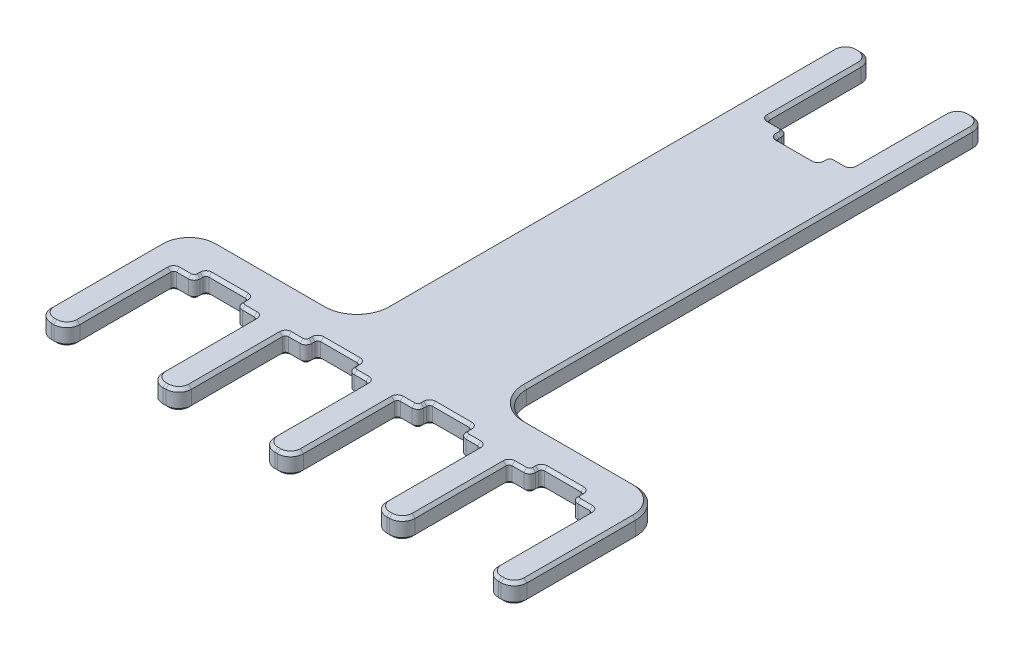
from build123d import *

# Parameters (mm, degrees)
BOSS_EXTRUDE1_DEPTH = 3.4
SKETCH3_W           = 7.2
SKETCH3_H           = 2
CUT_EXTRUDE1_DEPTH  = 3.4
FILLET1_R           = 5
FILLET2_R           = 2.2
FILLET3_R           = 0.5
FILLET4_R           = 1
CHAMFER1_SIZE       = 0.5


with BuildPart() as part:
    # Sketch1 → Boss-Extrude1 (new body)
    with BuildSketch(Plane(origin=(0, 0, 0), x_dir=(1, 0, 0), z_dir=(0, 1, 0))):
        Polygon((-29.141666667, 5.925), (-0.566666667, 5.925), (-0.566666667, 89.125), (4.283333333, 89.125), (4.283333333, 70.925), (18.483333333, 70.925), (18.483333333, 89.125), (23.333333333, 89.125), (23.333333333, 5.925), (51.908333333, 5.925), (51.908333333, -19.775), (-29.141666667, -19.775), align=None)
    extrude(amount=BOSS_EXTRUDE1_DEPTH)

    # Sketch3 → Cut-Extrude1 (cut)
    with BuildSketch(Plane(origin=(0, 3.4, 0), x_dir=(1, 0, 0), z_dir=(0, 1, 0))):
        Polygon((-24.291666667, -1.575), (-24.291666667, -19.775), (-10.091666667, -19.775), (-10.091666667, -1.575), (-13.591666667, -1.575), (-13.591666667, 0.425), (-20.791666667, 0.425), (-20.791666667, -1.575), align=None)
        Polygon((-5.241666667, -1.575), (-5.241666667, -19.775), (8.958333333, -19.775), (8.958333333, -1.575), (5.458333333, -1.575), (5.458333333, 0.425), (-1.741666667, 0.425), (-1.741666667, -1.575), align=None)
        Polygon((13.808333333, -1.575), (13.808333333, -19.775), (28.008333333, -19.775), (28.008333333, -1.575), (24.508333333, -1.575), (24.508333333, 0.425), (17.308333333, 0.425), (17.308333333, -1.575), align=None)
        Polygon((32.858333333, -1.575), (32.858333333, -19.775), (47.058333333, -19.775), (47.058333333, -1.575), (43.558333333, -1.575), (43.558333333, 0.425), (36.358333333, 0.425), (36.358333333, -1.575), align=None)
        with Locations((11.383333333, 69.925)):
            Rectangle(SKETCH3_W, SKETCH3_H)
    extrude(amount=-CUT_EXTRUDE1_DEPTH, mode=Mode.SUBTRACT)

    # Fillet1
    fillet1_edges = [part.edges().sort_by_distance(p)[0] for p in [
        (-29.141666667, 1.7, -5.925),
        (-0.566666667, 1.7, -5.925),
        (23.333333333, 1.7, -5.925),
        (51.908333333, 1.7, -5.925),
    ]]
    fillet(fillet1_edges, radius=FILLET1_R)

    # Fillet2
    fillet2_edges = [part.edges().sort_by_distance(p)[0] for p in [
        (28.008333333, 1.7, 19.775),
        (13.808333333, 1.7, 19.775),
        (8.958333333, 1.7, 19.775),
        (-5.241666667, 1.7, 19.775),
        (-0.566666667, 1.7, -89.125),
        (4.283333333, 1.7, -89.125),
        (18.483333333, 1.7, -89.125),
        (23.333333333, 1.7, -89.125),
        (51.908333333, 1.7, 19.775),
        (-29.141666667, 1.7, 19.775),
        (-10.091666667, 1.7, 19.775),
        (-24.291666667, 1.7, 19.775),
        (47.058333333, 1.7, 19.775),
        (32.858333333, 1.7, 19.775),
    ]]
    fillet(fillet2_edges, radius=FILLET2_R)

    # Fillet3
    fillet3_edges = [part.edges().sort_by_distance(p)[0] for p in [
        (13.808333333, 1.7, 1.575),
        (17.308333333, 1.7, -0.425),
        (24.508333333, 1.7, -0.425),
        (28.008333333, 1.7, 1.575),
        (-5.241666667, 1.7, 1.575),
        (-1.741666667, 1.7, -0.425),
        (5.458333333, 1.7, -0.425),
        (8.958333333, 1.7, 1.575),
        (4.283333333, 1.7, -70.925),
        (18.483333333, 1.7, -70.925),
        (-24.291666667, 1.7, 1.575),
        (-20.791666667, 1.7, -0.425),
        (-13.591666667, 1.7, -0.425),
        (-10.091666667, 1.7, 1.575),
        (14.983333333, 1.7, -68.925),
        (7.783333333, 1.7, -68.925),
        (32.858333333, 1.7, 1.575),
        (36.358333333, 1.7, -0.425),
        (43.558333333, 1.7, -0.425),
        (47.058333333, 1.7, 1.575),
    ]]
    fillet(fillet3_edges, radius=FILLET3_R)

    # Fillet4
    fillet4_edges = [part.edges().sort_by_distance(p)[0] for p in [
        (17.308333333, 1.7, 1.575),
        (24.508333333, 1.7, 1.575),
        (-1.741666667, 1.7, 1.575),
        (5.458333333, 1.7, 1.575),
        (-20.791666667, 1.7, 1.575),
        (-13.591666667, 1.7, 1.575),
        (7.783333333, 1.7, -70.925),
        (14.983333333, 1.7, -70.925),
        (36.358333333, 1.7, 1.575),
        (43.558333333, 1.7, 1.575),
    ]]
    fillet(fillet4_edges, radius=FILLET4_R)

    # Chamfer1
    chamfer1_edges = [part.edges().sort_by_distance(p)[0] for p in [
        (-29.141666667, 0, 8.325),
        (-29.141666667, 3.4, 8.325),
        (-14.854166667, 0, -5.925),
        (23.333333333, 0, -48.925),
        (37.620833333, 0, -5.925),
        (50.443867239, 0, -4.460533906),
        (-27.677200573, 0, -4.460533906),
        (-14.854166667, 3.4, -5.925),
        (37.620833333, 3.4, -5.925),
        (23.333333333, 3.4, -48.925),
        (50.443867239, 3.4, -4.460533906),
        (-27.677200573, 3.4, -4.460533906),
        (24.797799427, 0, -7.389466094),
        (24.797799427, 3.4, -7.389466094),
        (-2.031132761, 0, -7.389466094),
        (-2.031132761, 3.4, -7.389466094),
        (-0.566666667, 0, -48.925),
        (-0.566666667, 3.4, -48.925),
        (1.858333333, 0, -89.125),
        (18.483333333, 0, -79.175),
        (20.908333333, 0, -89.125),
        (51.908333333, 0, 8.325),
        (49.483333333, 0, 19.775),
        (47.058333333, 0, 9.825),
        (30.433333333, 0, 19.775),
        (28.008333333, 0, 9.825),
        (11.383333333, 0, 19.775),
        (8.958333333, 0, 9.825),
        (-7.666666667, 0, 19.775),
        (-10.091666667, 0, 9.825),
        (-26.716666667, 0, 19.775),
        (-28.497301585, 0, 19.130634919),
        (-24.936031748, 0, 19.130634919),
        (-9.447301585, 0, 19.130634919),
        (-5.886031748, 0, 19.130634919),
        (9.602698415, 0, 19.130634919),
        (13.163968252, 0, 19.130634919),
        (28.652698415, 0, 19.130634919),
        (32.213968252, 0, 19.130634919),
        (47.702698415, 0, 19.130634919),
        (51.263968252, 0, 19.130634919),
        (22.688968252, 0, -88.480634919),
        (19.127698415, 0, -88.480634919),
        (3.638968252, 0, -88.480634919),
        (0.077698415, 0, -88.480634919),
        (1.858333333, 3.4, -89.125),
        (-26.716666667, 3.4, 19.775),
        (-10.091666667, 3.4, 9.825),
        (-7.666666667, 3.4, 19.775),
        (8.958333333, 3.4, 9.825),
        (11.383333333, 3.4, 19.775),
        (28.008333333, 3.4, 9.825),
        (30.433333333, 3.4, 19.775),
        (47.058333333, 3.4, 9.825),
        (49.483333333, 3.4, 19.775),
        (51.908333333, 3.4, 8.325),
        (20.908333333, 3.4, -89.125),
        (18.483333333, 3.4, -79.175),
        (-28.497301585, 3.4, 19.130634919),
        (-24.936031748, 3.4, 19.130634919),
        (-9.447301585, 3.4, 19.130634919),
        (-5.886031748, 3.4, 19.130634919),
        (9.602698415, 3.4, 19.130634919),
        (13.163968252, 3.4, 19.130634919),
        (28.652698415, 3.4, 19.130634919),
        (32.213968252, 3.4, 19.130634919),
        (47.702698415, 3.4, 19.130634919),
        (51.263968252, 3.4, 19.130634919),
        (22.688968252, 3.4, -88.480634919),
        (19.127698415, 3.4, -88.480634919),
        (3.638968252, 3.4, -88.480634919),
        (0.077698415, 3.4, -88.480634919),
        (11.383333333, 3.4, -68.925),
        (11.383333333, 0, -68.925),
        (14.983333333, 3.4, -69.675),
        (14.983333333, 0, -69.675),
        (16.983333333, 0, -70.925),
        (16.983333333, 3.4, -70.925),
        (4.283333333, 0, -79.175),
        (4.283333333, 3.4, -79.175),
        (17.308333333, 3.4, 0.325),
        (17.308333333, 0, 0.325),
        (20.908333333, 3.4, -0.425),
        (20.908333333, 0, -0.425),
        (-1.741666667, 3.4, 0.325),
        (-1.741666667, 0, 0.325),
        (1.858333333, 3.4, -0.425),
        (1.858333333, 0, -0.425),
        (-20.791666667, 3.4, 0.325),
        (-20.791666667, 0, 0.325),
        (-17.191666667, 3.4, -0.425),
        (-17.191666667, 0, -0.425),
        (36.358333333, 3.4, 0.325),
        (36.358333333, 0, 0.325),
        (39.958333333, 3.4, -0.425),
        (39.958333333, 0, -0.425),
        (45.558333333, 3.4, 1.575),
        (45.558333333, 0, 1.575),
        (32.858333333, 3.4, 9.825),
        (32.858333333, 0, 9.825),
        (13.808333333, 3.4, 9.825),
        (13.808333333, 0, 9.825),
        (26.508333333, 3.4, 1.575),
        (26.508333333, 0, 1.575),
        (7.458333333, 3.4, 1.575),
        (7.458333333, 0, 1.575),
        (-5.241666667, 3.4, 9.825),
        (-5.241666667, 0, 9.825),
        (-11.591666667, 3.4, 1.575),
        (-11.591666667, 0, 1.575),
        (-24.291666667, 3.4, 9.825),
        (-24.291666667, 0, 9.825),
        (7.929779943, 3.4, -69.071446609),
        (7.929779943, 0, -69.071446609),
        (14.836886724, 3.4, -69.071446609),
        (14.836886724, 0, -69.071446609),
        (18.336886724, 0, -71.071446609),
        (18.336886724, 3.4, -71.071446609),
        (4.429779943, 0, -71.071446609),
        (4.429779943, 3.4, -71.071446609),
        (17.454779943, 3.4, -0.278553391),
        (17.454779943, 0, -0.278553391),
        (-1.595220057, 3.4, -0.278553391),
        (-1.595220057, 0, -0.278553391),
        (-20.645220057, 3.4, -0.278553391),
        (-20.645220057, 0, -0.278553391),
        (-13.738113276, 3.4, -0.278553391),
        (-13.738113276, 0, -0.278553391),
        (5.311886724, 3.4, -0.278553391),
        (5.311886724, 0, -0.278553391),
        (24.361886724, 3.4, -0.278553391),
        (24.361886724, 0, -0.278553391),
        (36.504779943, 3.4, -0.278553391),
        (36.504779943, 0, -0.278553391),
        (43.411886724, 3.4, -0.278553391),
        (43.411886724, 0, -0.278553391),
        (46.911886724, 3.4, 1.721446609),
        (46.911886724, 0, 1.721446609),
        (33.004779943, 3.4, 1.721446609),
        (33.004779943, 0, 1.721446609),
        (13.954779943, 3.4, 1.721446609),
        (13.954779943, 0, 1.721446609),
        (27.861886724, 3.4, 1.721446609),
        (27.861886724, 0, 1.721446609),
        (8.811886724, 3.4, 1.721446609),
        (8.811886724, 0, 1.721446609),
        (-5.095220057, 3.4, 1.721446609),
        (-5.095220057, 0, 1.721446609),
        (-10.238113276, 3.4, 1.721446609),
        (-10.238113276, 0, 1.721446609),
        (-24.145220057, 3.4, 1.721446609),
        (-24.145220057, 0, 1.721446609),
        (-13.591666667, 3.4, 0.325),
        (-13.591666667, 0, 0.325),
        (-22.791666667, 3.4, 1.575),
        (-3.741666667, 3.4, 1.575),
        (5.458333333, 3.4, 0.325),
        (15.308333333, 3.4, 1.575),
        (24.508333333, 3.4, 0.325),
        (34.358333333, 3.4, 1.575),
        (43.558333333, 3.4, 0.325),
        (7.783333333, 3.4, -69.675),
        (5.783333333, 3.4, -70.925),
        (7.490440115, 3.4, -70.632106781),
        (15.276226552, 3.4, -70.632106781),
        (-21.084559885, 3.4, 1.282106781),
        (43.851226552, 3.4, 1.282106781),
        (36.065440115, 3.4, 1.282106781),
        (24.801226552, 3.4, 1.282106781),
        (17.015440115, 3.4, 1.282106781),
        (5.751226552, 3.4, 1.282106781),
        (-2.034559885, 3.4, 1.282106781),
        (-13.298773448, 3.4, 1.282106781),
        (5.783333333, 0, -70.925),
        (7.783333333, 0, -69.675),
        (43.558333333, 0, 0.325),
        (34.358333333, 0, 1.575),
        (24.508333333, 0, 0.325),
        (15.308333333, 0, 1.575),
        (5.458333333, 0, 0.325),
        (-3.741666667, 0, 1.575),
        (-22.791666667, 0, 1.575),
        (7.490440115, 0, -70.632106781),
        (15.276226552, 0, -70.632106781),
        (-21.084559885, 0, 1.282106781),
        (43.851226552, 0, 1.282106781),
        (36.065440115, 0, 1.282106781),
        (24.801226552, 0, 1.282106781),
        (17.015440115, 0, 1.282106781),
        (5.751226552, 0, 1.282106781),
        (-2.034559885, 0, 1.282106781),
        (-13.298773448, 0, 1.282106781),
    ]]
    chamfer(chamfer1_edges, length=CHAMFER1_SIZE)


solid = part.part
